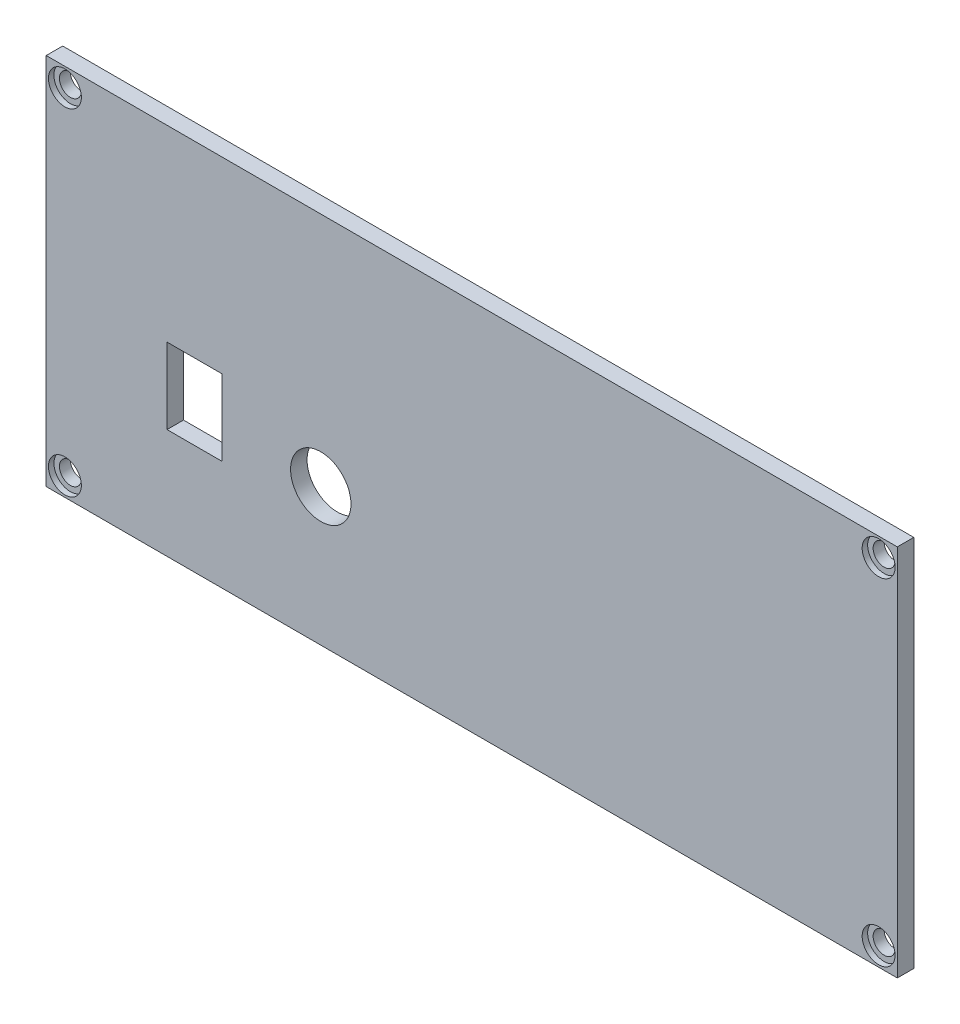
from build123d import *

# Parameters (mm, degrees)
IZIM1_W                     = 155
IZIM1_H                     = 68
Y_KSEKLIK_EKSTR_ZYON1_DEPTH = 3
IZIM2_R                     = 5.5
IZIM2_W                     = 10
IZIM2_H                     = 13.8
KES_EKSTR_ZYON1_DEPTH       = 3
IZIM3_R                     = 2
KES_EKSTR_ZYON2_DEPTH       = 3
IZIM4_R                     = 3
KES_EKSTR_ZYON3_DEPTH       = 1


with BuildPart() as part:
    # Çizim1 → Yükseklik-Ekstrüzyon1 (new body)
    with BuildSketch(Plane.XY):
        with Locations((-77.5, 34)):
            Rectangle(IZIM1_W, IZIM1_H)
    extrude(amount=Y_KSEKLIK_EKSTR_ZYON1_DEPTH)

    # Çizim2 → Kes-Ekstrüzyon1 (cut)
    with BuildSketch(Plane.XY.offset(3)):
        with Locations((-105, 25)):
            Circle(IZIM2_R)
        with Locations((-128, 26.9)):
            Rectangle(IZIM2_W, IZIM2_H)
    extrude(amount=-KES_EKSTR_ZYON1_DEPTH, mode=Mode.SUBTRACT)

    # Çizim3 → Kes-Ekstrüzyon2 (cut)
    with BuildSketch(Plane.XY.offset(3)):
        with Locations((-151.6, 64.6)):
            Circle(IZIM3_R)
        with Locations(Location((-3.4, 64.6, 0), (0, 0, 180))):
            Circle(IZIM3_R)
        with Locations(Location((-151.6, 3.4, 0), (0, 0, 180))):
            Circle(IZIM3_R)
        with Locations((-3.4, 3.4)):
            Circle(IZIM3_R)
    extrude(amount=-KES_EKSTR_ZYON2_DEPTH, mode=Mode.SUBTRACT)

    # Çizim4 → Kes-Ekstrüzyon3 (cut)
    with BuildSketch(Plane.XY.offset(3)):
        with Locations((-151.6, 64.6)):
            Circle(IZIM4_R)
        with Locations(Location((-3.4, 64.6, 0), (0, 0, 180))):
            Circle(IZIM4_R)
        with Locations((-3.4, 3.4)):
            Circle(IZIM4_R)
        with Locations(Location((-151.6, 3.4, 0), (0, 0, 180))):
            Circle(IZIM4_R)
    extrude(amount=-KES_EKSTR_ZYON3_DEPTH, mode=Mode.SUBTRACT)


solid = part.part
